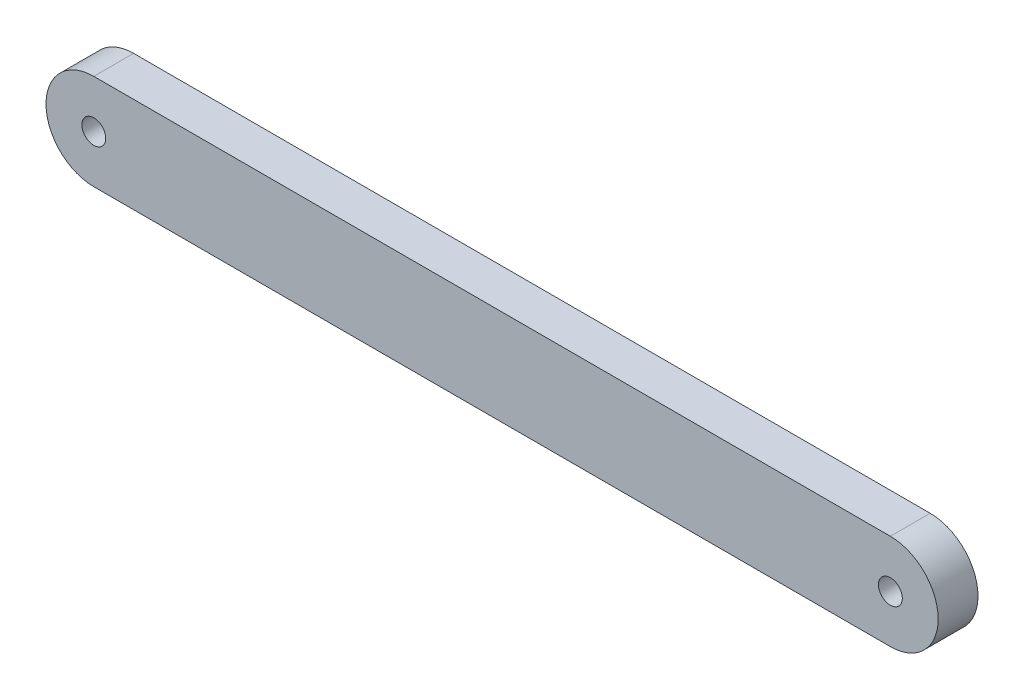
from build123d import *

# Parameters (mm, degrees)
ESQUISSE1_R        = 1.5
BOSS_EXTRU_1_DEPTH = 5


with BuildPart() as part:
    # Esquisse1 → Boss.-Extru.1 (new body)
    with BuildSketch(Plane.XY):
        with BuildLine():
            Line((-50, 6), (50, 6))
            ThreePointArc((50, 6), (56, 0), (50, -6))
            Line((50, -6), (-50, -6))
            ThreePointArc((-50, -6), (-56, 0), (-50, 6))
        make_face()
        with Locations((-50, 0)):
            Circle(ESQUISSE1_R, mode=Mode.SUBTRACT)
        with Locations((50, 0)):
            Circle(ESQUISSE1_R, mode=Mode.SUBTRACT)
    extrude(amount=BOSS_EXTRU_1_DEPTH)


solid = part.part
